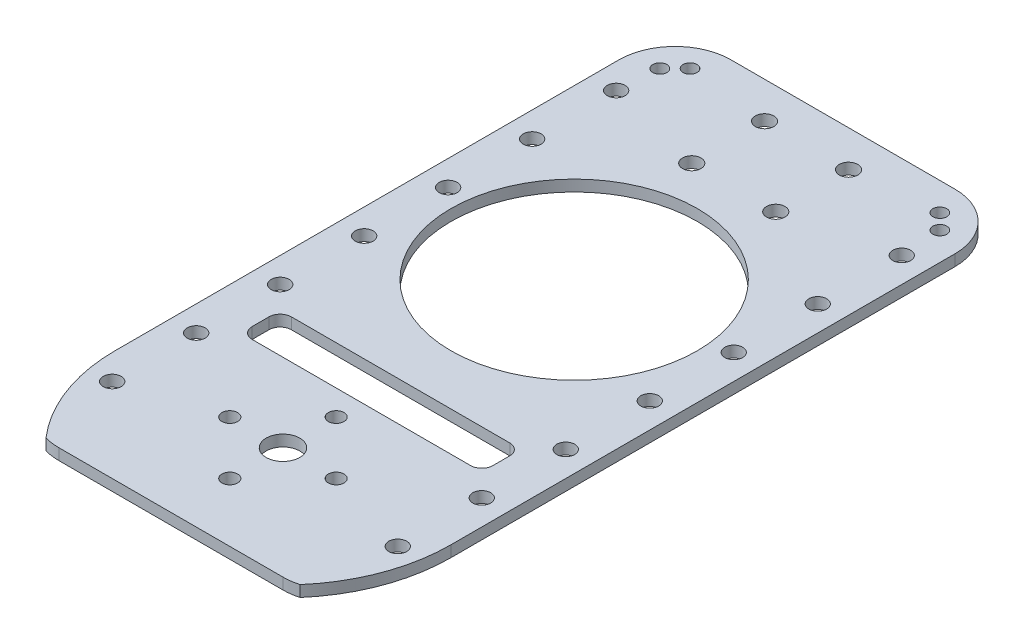
from build123d import *

# Parameters (mm, degrees)
SKETCH_1_W          = 60
SKETCH_1_H          = 80
EXTRUDE_1_DEPTH     = 2
SKETCH_2_R          = 1.4
CUT_EXTRUDE_1_DEPTH = 50
SKETCH_3_R          = 2
CUT_EXTRUDE_2_DEPTH = 50
SKETCH_5_W          = 60
SKETCH_5_H          = 40
EXTRUDE_2_DEPTH     = 2
SKETCH_6_R          = 22
CUT_EXTRUDE_4_DEPTH = 50
SKETCH_4_R          = 1.65
CUT_EXTRUDE_3_DEPTH = 50
SKETCH_7_R          = 3
CUT_EXTRUDE_5_DEPTH = 14
SKETCH_8_R          = 1.6
CUT_EXTRUDE_6_DEPTH = 10
FILLET_1_R          = 10
CUT_EXTRUDE_7_DEPTH = 10
SKETCH_10_R         = 1.25
CUT_EXTRUDE_8_DEPTH = 10
SKETCH_11_W         = 43
SKETCH_11_H         = 7
CUT_EXTRUDE_9_DEPTH = 10
FILLET_2_R          = 2


with BuildPart() as part:
    # 草图1 → 凸台-拉伸1 (new body)
    with BuildSketch(Plane(origin=(0, 0, 0), x_dir=(1, 0, 0), z_dir=(0, 1, 0))):
        Rectangle(SKETCH_1_W, SKETCH_1_H)
    extrude(amount=EXTRUDE_1_DEPTH)

    # 草图2 → 切除-拉伸1 (cut)
    with BuildSketch(Plane(origin=(0, 2, 0), x_dir=(1, 0, 0), z_dir=(0, 1, 0))):
        with Locations(Location((0, -10.50070918, 0), (0, 0, 270))):
            Circle(SKETCH_2_R)
        with Locations(Location((9.49929082, -20, 0), (0, 0, 270))):
            Circle(SKETCH_2_R)
        with Locations(Location((0, -29.49929082, 0), (0, 0, 270))):
            Circle(SKETCH_2_R)
        with Locations(Location((-9.49929082, -20, 0), (0, 0, 270))):
            Circle(SKETCH_2_R)
    extrude(amount=-CUT_EXTRUDE_1_DEPTH, mode=Mode.SUBTRACT)

    # 草图3 → 切除-拉伸2 (cut)
    with BuildSketch(Plane(origin=(0, 2, 0), x_dir=(1, 0, 0), z_dir=(0, 1, 0))):
        with Locations(Location((0, -20, 0), (0, 0, 270))):
            Circle(SKETCH_3_R)
    extrude(amount=-CUT_EXTRUDE_2_DEPTH, mode=Mode.SUBTRACT)

    # 草图5 → 凸台-拉伸2 (add)
    with BuildSketch(Plane(origin=(0, 2, 0), x_dir=(1, 0, 0), z_dir=(0, 1, 0))):
        with Locations((0, 60)):
            Rectangle(SKETCH_5_W, SKETCH_5_H)
    extrude(amount=-EXTRUDE_2_DEPTH)

    # 草图6 → 切除-拉伸4 (cut)
    with BuildSketch(Plane(origin=(0, 2, 0), x_dir=(1, 0, 0), z_dir=(0, 1, 0))):
        with Locations(Location((0, 32, 0), (0, 0, 270))):
            Circle(SKETCH_6_R)
    extrude(amount=-CUT_EXTRUDE_4_DEPTH, mode=Mode.SUBTRACT)

    # 草图4 → 切除-拉伸3 (cut)
    with BuildSketch(Plane(origin=(0, 2, 0), x_dir=(1, 0, 0), z_dir=(0, 1, 0))):
        with Locations(Location((-7.5, 73.5, 0), (0, 0, 270))):
            Circle(SKETCH_4_R)
        with Locations(Location((7.5, 73.5, 0), (0, 0, 270))):
            Circle(SKETCH_4_R)
        with Locations(Location((7.5, 60.5, 0), (0, 0, 270))):
            Circle(SKETCH_4_R)
        with Locations(Location((-7.5, 60.5, 0), (0, 0, 270))):
            Circle(SKETCH_4_R)
    extrude(amount=-CUT_EXTRUDE_3_DEPTH, mode=Mode.SUBTRACT)

    # 草图7 → 切除-拉伸5 (cut)
    with BuildSketch(Plane(origin=(0, 2, 0), x_dir=(1, 0, 0), z_dir=(0, 1, 0))):
        with Locations(Location((0, -20, 0), (0, 0, 270))):
            Circle(SKETCH_7_R)
    extrude(amount=-CUT_EXTRUDE_5_DEPTH, mode=Mode.SUBTRACT)

    # 草图8 → 切除-拉伸6 (cut)
    with BuildSketch(Plane(origin=(0, 2, 0), x_dir=(1, 0, 0), z_dir=(0, 1, 0))):
        with Locations(Location((-25.5, 20, 0), (0, 0, 270))):
            Circle(SKETCH_8_R)
        with Locations(Location((-25.5, 5, 0), (0, 0, 270))):
            Circle(SKETCH_8_R)
        with Locations(Location((-25.5, -10, 0), (0, 0, 270))):
            Circle(SKETCH_8_R)
        with Locations(Location((-25.5, -25, 0), (0, 0, 270))):
            Circle(SKETCH_8_R)
        with Locations(Location((-25.5, 65, 0), (0, 0, 270))):
            Circle(SKETCH_8_R)
        with Locations(Location((-25.5, 50, 0), (0, 0, 270))):
            Circle(SKETCH_8_R)
        with Locations(Location((-25.5, 35, 0), (0, 0, 270))):
            Circle(SKETCH_8_R)
        with Locations(Location((25.5, 35, 0), (0, 0, 270))):
            Circle(SKETCH_8_R)
        with Locations(Location((25.5, 50, 0), (0, 0, 270))):
            Circle(SKETCH_8_R)
        with Locations(Location((25.5, 65, 0), (0, 0, 270))):
            Circle(SKETCH_8_R)
        with Locations(Location((25.5, -25, 0), (0, 0, 270))):
            Circle(SKETCH_8_R)
        with Locations(Location((25.5, -10, 0), (0, 0, 270))):
            Circle(SKETCH_8_R)
        with Locations(Location((25.5, 5, 0), (0, 0, 270))):
            Circle(SKETCH_8_R)
        with Locations(Location((25.5, 20, 0), (0, 0, 270))):
            Circle(SKETCH_8_R)
    extrude(amount=-CUT_EXTRUDE_6_DEPTH, mode=Mode.SUBTRACT)

    # 圆角1
    fillet_1_edges = [part.edges().sort_by_distance(p)[0] for p in [
        (-30, 1, -80),
        (30, 1, -80),
        (30, 1, 40),
        (-30, 1, 40),
    ]]
    fillet(fillet_1_edges, radius=FILLET_1_R)

    # 草图9 → 切除-拉伸7 (cut)
    with BuildSketch(Plane(origin=(0, 2, 0), x_dir=(1, 0, 0), z_dir=(0, 1, 0))):
        with BuildLine():
            ThreePointArc((-30, -30), (-27.963471357, -36.048398462), (-22.68337521, -39.633249581))
            ThreePointArc((-22.68337521, -39.633249581), (-28.111396766, -30.47613344), (-30, -20))
            Line((-30, -20), (-30, -30))
        make_face()
        with BuildLine():
            ThreePointArc((22.68337521, -39.633249581), (27.963471357, -36.048398462), (30, -30))
            Line((30, -30), (30, -20))
            ThreePointArc((30, -20), (28.111396766, -30.47613344), (22.68337521, -39.633249581))
        make_face()
    extrude(amount=-CUT_EXTRUDE_7_DEPTH, mode=Mode.SUBTRACT)

    # 草图10 → 切除-拉伸8 (cut)
    with BuildSketch(Plane(origin=(0, 2, 0), x_dir=(1, 0, 0), z_dir=(0, 1, 0))):
        with Locations(Location((-22.3, 75, 0), (0, 0, 270))):
            Circle(SKETCH_10_R)
        with Locations(Location((-25, 72.3, 0), (0, 0, 270))):
            Circle(SKETCH_10_R)
        with Locations(Location((25, 72.3, 0), (0, 0, 270))):
            Circle(SKETCH_10_R)
        with Locations(Location((22.3, 75, 0), (0, 0, 270))):
            Circle(SKETCH_10_R)
    extrude(amount=-CUT_EXTRUDE_8_DEPTH, mode=Mode.SUBTRACT)

    # 草图11 → 切除-拉伸9 (cut)
    with BuildSketch(Plane(origin=(0, 0, 0), x_dir=(-1, 0, 0), z_dir=(0, -1, 0))):
        with Locations((0, -2.5)):
            Rectangle(SKETCH_11_W, SKETCH_11_H)
    extrude(amount=-CUT_EXTRUDE_9_DEPTH, mode=Mode.SUBTRACT)

    # 圆角2
    fillet_2_edges = [part.edges().sort_by_distance(p)[0] for p in [
        (21.5, 1, 6),
        (21.5, 1, -1),
        (-21.5, 1, -1),
        (-21.5, 1, 6),
    ]]
    fillet(fillet_2_edges, radius=FILLET_2_R)


solid = part.part
